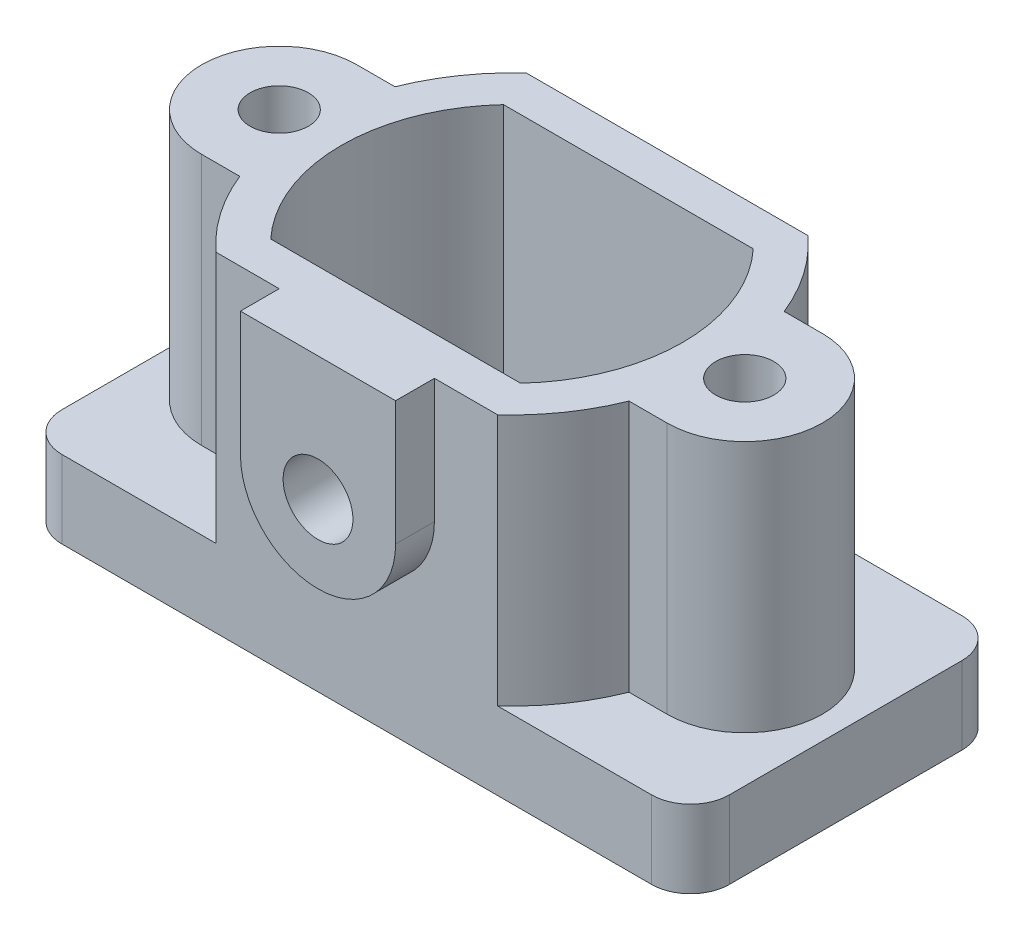
from build123d import *

# Parameters (mm, degrees)
EXTRUDE_1_DEPTH          = 20
CUT_EXTRUDE_1_DEPTH      = 97.932966528
CUT_EXTRUDE_1_DEPTH_BACK = 97.932966528
SKETCH_3_R               = 7.5
EXTRUDE_2_DEPTH          = 65
CUT_EXTRUDE_2_DEPTH      = 128.361689687
CUT_EXTRUDE_2_DEPTH_BACK = 128.361689687
SKETCH_5_R               = 7.5
SKETCH_6_R               = 9
EXTRUDE_3_DEPTH          = 10
CUT_EXTRUDE_3_DEPTH      = 151.73486657
CUT_EXTRUDE_3_DEPTH_BACK = 20
SKETCH_7_R               = 9


with BuildPart() as part:
    # 草图1 → 凸台-拉伸1 (new body)
    with BuildSketch(Plane(origin=(0, 0, 0), x_dir=(1, 0, 0), z_dir=(0, 1, 0))):
        with BuildLine():
            Line((-76, 40), (76, 40))
            ThreePointArc((76, 40), (83.071067812, 37.071067812), (86, 30))
            Line((86, 30), (86, -30))
            ThreePointArc((86, -30), (83.071067812, -37.071067812), (76, -40))
            Line((76, -40), (-76, -40))
            ThreePointArc((-76, -40), (-83.071067812, -37.071067812), (-86, -30))
            Line((-86, -30), (-86, 30))
            ThreePointArc((-86, 30), (-83.071067812, 37.071067812), (-76, 40))
        make_face()
    extrude(amount=EXTRUDE_1_DEPTH)

    # 草图2 → 切除-拉伸1 (cut, two sides: drawn at the far end of the back side and taken through both)
    with BuildSketch(Plane(origin=(0, 20, 0), x_dir=(1, 0, 0), z_dir=(0, 1, 0)).offset(-CUT_EXTRUDE_1_DEPTH_BACK)):
        with BuildLine():
            Line((33.813047991, 12.5), (33.813047991, -12.5))
            Line((33.813047991, -12.5), (18.708286934, -12.5))
            ThreePointArc((18.708286934, -12.5), (0, -22.5), (-18.708286934, -12.5))
            Line((-18.708286934, -12.5), (-33.813047991, -12.5))
            Line((-33.813047991, -12.5), (-33.813047991, 12.5))
            Line((-33.813047991, 12.5), (-18.708286934, 12.5))
            ThreePointArc((-18.708286934, 12.5), (0, 22.5), (18.708286934, 12.5))
            Line((18.708286934, 12.5), (33.813047991, 12.5))
        make_face()
    extrude(amount=CUT_EXTRUDE_1_DEPTH + CUT_EXTRUDE_1_DEPTH_BACK, mode=Mode.SUBTRACT)

    # 草图3 → 凸台-拉伸2 (add)
    with BuildSketch(Plane(origin=(0, 20, 0), x_dir=(1, 0, 0), z_dir=(0, 1, 0))):
        with BuildLine():
            ThreePointArc((60, -20), (80, 0), (60, 20))
            Line((60, 20), (50.159744816, 20))
            ThreePointArc((50.159744816, 20), (44.36006499, 30.792606809), (36.276714294, 40))
            Line((36.276714294, 40), (-36.276714294, 40))
            ThreePointArc((-36.276714294, 40), (-44.36006499, 30.792606809), (-50.159744816, 20))
            Line((-50.159744816, 20), (-60, 20))
            ThreePointArc((-60, 20), (-80, 0), (-60, -20))
            Line((-60, -20), (-50.159744816, -20))
            ThreePointArc((-50.159744816, -20), (-44.36006499, -30.792606809), (-36.276714294, -40))
            Line((-36.276714294, -40), (36.276714294, -40))
            ThreePointArc((36.276714294, -40), (44.36006499, -30.792606809), (50.159744816, -20))
            Line((50.159744816, -20), (60, -20))
        make_face()
        with Locations(Location((-60, 0, 0), (0, 0, 270))):
            Circle(SKETCH_3_R, mode=Mode.SUBTRACT)
        with BuildLine():
            Line((30, -30), (-30, -30))
            Line((-30, -30), (-32.186953879, -30))
            ThreePointArc((-32.186953879, -30), (-44, 0), (-32.186953879, 30))
            Line((-32.186953879, 30), (32.186953879, 30))
            ThreePointArc((32.186953879, 30), (44, 0), (32.186953879, -30))
            Line((32.186953879, -30), (30, -30))
        make_face(mode=Mode.SUBTRACT)
        with BuildLine():
            ThreePointArc((53.83125, 4.265738323), (62.234320366, 7.15945616), (67.5, 0))
            ThreePointArc((67.5, 0), (62.234320366, -7.15945616), (53.83125, -4.265738323))
            ThreePointArc((53.83125, -4.265738323), (52.5, 0), (53.83125, 4.265738323))
        make_face(mode=Mode.SUBTRACT)
    extrude(amount=EXTRUDE_2_DEPTH)

    # 草图5 → 切除-拉伸2 (cut, two sides: drawn at the far end of the back side and taken through both)
    with BuildSketch(Plane(origin=(0, 85, 0), x_dir=(1, 0, 0), z_dir=(0, 1, 0)).offset(-CUT_EXTRUDE_2_DEPTH_BACK)):
        with Locations(Location((60, 0, 0), (0, 0, 270))):
            Circle(SKETCH_5_R)
        with Locations(Location((-60, 0, 0), (0, 0, 270))):
            Circle(SKETCH_5_R)
    extrude(amount=CUT_EXTRUDE_2_DEPTH + CUT_EXTRUDE_2_DEPTH_BACK, mode=Mode.SUBTRACT)

    # 草图6 → 凸台-拉伸3 (add)
    with BuildSketch(Plane.XY.offset(40)):
        with BuildLine():
            Line((0, 85), (-20, 85))
            Line((-20, 85), (-20, 53))
            ThreePointArc((-20, 53), (0, 33), (20, 53))
            Line((20, 53), (20, 85))
            Line((20, 85), (0, 85))
        make_face()
        with Locations((0, 53)):
            Circle(SKETCH_6_R, mode=Mode.SUBTRACT)
    extrude(amount=EXTRUDE_3_DEPTH)

    # 草图7 → 切除-拉伸3 (cut, two sides: drawn at the far end of the back side and taken through both)
    with BuildSketch(Plane.XY.offset(50).offset(-CUT_EXTRUDE_3_DEPTH_BACK)):
        with Locations(Location((0, 53, 0), (0, 0, 180))):
            Circle(SKETCH_7_R)
    extrude(amount=CUT_EXTRUDE_3_DEPTH + CUT_EXTRUDE_3_DEPTH_BACK, mode=Mode.SUBTRACT)


solid = part.part
